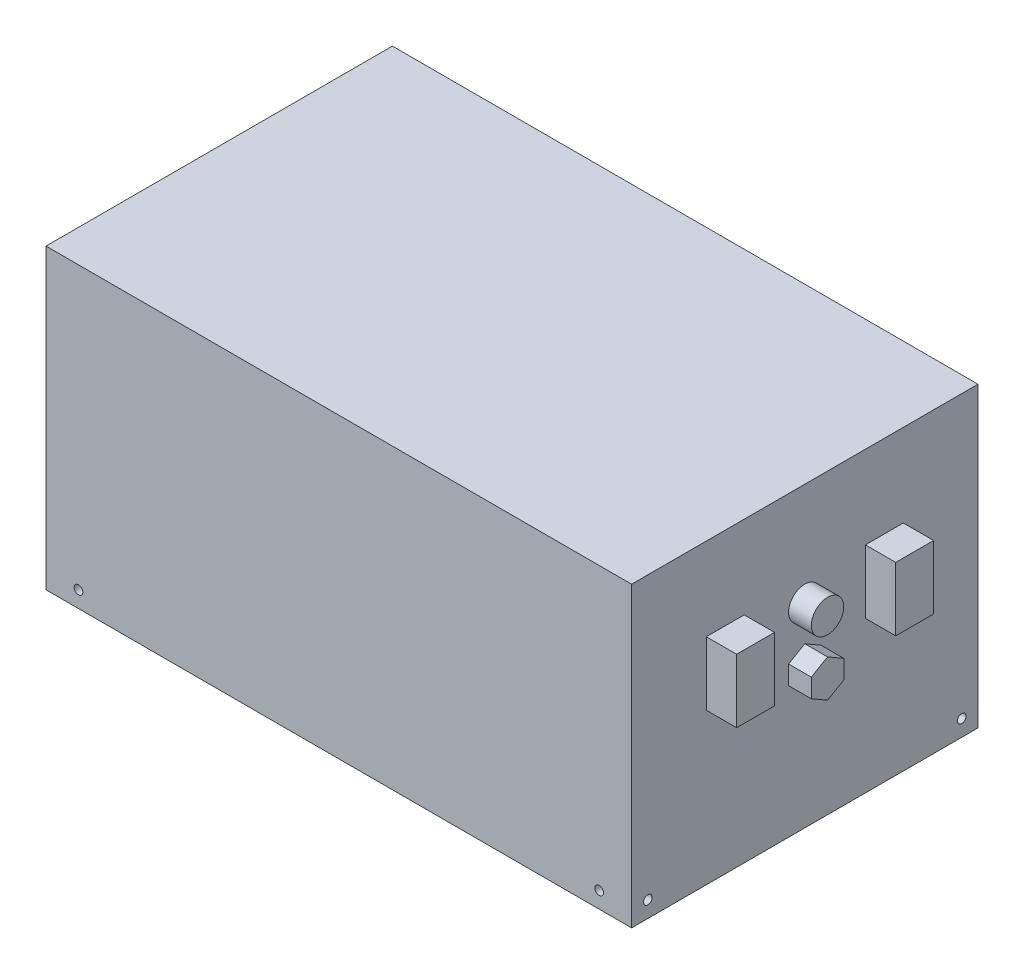
from build123d import *

# Parameters (mm, degrees)
SCHIZZO1_W                   = 541
SCHIZZO1_H                   = 320
ESTRUSIONE_ESTRUSIONE1_DEPTH = 275
SCHIZZO2_W                   = 35
SCHIZZO2_H                   = 58.8
ESTRUSIONE_ESTRUSIONE2_DEPTH = 28
SCHIZZO3_R                   = 15
ESTRUSIONE_ESTRUSIONE3_DEPTH = 21
SCHIZZO4_R                   = 4
TAGLIO_ESTRUSIONE1_DEPTH     = 15
SCHIZZO5_R                   = 4
TAGLIO_ESTRUSIONE2_DEPTH     = 15


with BuildPart() as part:
    # Schizzo1 → Estrusione-Estrusione1 (new body)
    with BuildSketch(Plane(origin=(0, 0, 0), x_dir=(1, 0, 0), z_dir=(0, 1, 0))):
        Rectangle(SCHIZZO1_W, SCHIZZO1_H)
    extrude(amount=ESTRUSIONE_ESTRUSIONE1_DEPTH)

    # Schizzo2 → Estrusione-Estrusione2 (add)
    with BuildSketch(Plane(origin=(270.5, 0, 0), x_dir=(0, 0, -1), z_dir=(1, 0, 0))):
        with Locations((-73.5, 169.05)):
            Rectangle(SCHIZZO2_W, SCHIZZO2_H)
        with Locations((73.5, 169.05)):
            Rectangle(SCHIZZO2_W, SCHIZZO2_H)
    extrude(amount=ESTRUSIONE_ESTRUSIONE2_DEPTH)

    # Schizzo3 → Estrusione-Estrusione3 (add)
    with BuildSketch(Plane(origin=(270.5, 0, 0), x_dir=(0, 0, -1), z_dir=(1, 0, 0))):
        with Locations(Location((0, 180, 0), (0, 0, 180))):
            Circle(SCHIZZO3_R)
        Polygon((0, 147.320508076), (-15, 138.660254038), (-15, 121.339745962), (0, 112.679491924), (15, 121.339745962), (15, 138.660254038), align=None)
    extrude(amount=ESTRUSIONE_ESTRUSIONE3_DEPTH)

    # Schizzo4 → Taglio-Estrusione1 (cut)
    with BuildSketch(Plane(origin=(270.5, 0, 0), x_dir=(0, 0, -1), z_dir=(1, 0, 0))):
        with Locations((-145, 15)):
            Circle(SCHIZZO4_R)
        with Locations((145, 15)):
            Circle(SCHIZZO4_R)
    taglio_estrusione1 = extrude(amount=-TAGLIO_ESTRUSIONE1_DEPTH, mode=Mode.SUBTRACT)

    # Specchia1: Taglio-Estrusione1 across plane
    add(taglio_estrusione1.mirror(Plane(origin=(0, 0, 0), x_dir=(0, 0, 1), z_dir=(1, 0, 0))), mode=Mode.SUBTRACT)

    # Schizzo5 → Taglio-Estrusione2 (cut)
    with BuildSketch(Plane.XY.offset(160)):
        with Locations((-240.5, 15)):
            Circle(SCHIZZO5_R)
        with Locations((240.5, 15)):
            Circle(SCHIZZO5_R)
    extrude(amount=-TAGLIO_ESTRUSIONE2_DEPTH, mode=Mode.SUBTRACT)


solid = part.part
